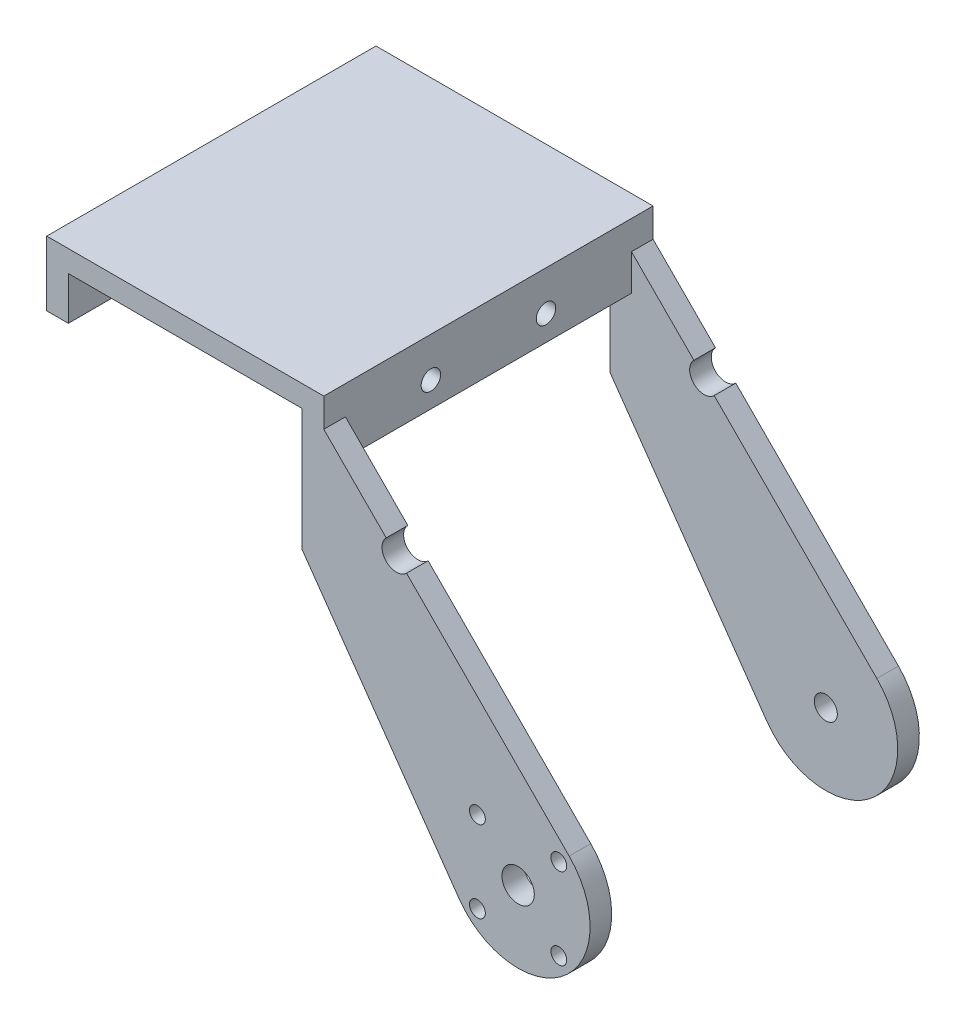
from build123d import *

# Parameters (mm, degrees)
BOSS_EXTRUDE1_DEPTH = 3
SKETCH1_3_W         = 3
SKETCH1_3_H         = 45.75
SKETCH1_3_H_2       = 39.75
BOSS_EXTRUDE2_DEPTH = 9
SKETCH1_4_W         = 3
SKETCH1_4_H         = 45.75
BOSS_EXTRUDE3_DEPTH = 6
CUT_EXTRUDE1_REACH  = 47.678
SKETCH3_R           = 1.35
SKETCH1_5_W         = 3
SKETCH1_5_H         = 3
BOSS_EXTRUDE4_DEPTH = 20
BOSS_EXTRUDE5_DEPTH = 3
SKETCH5_R           = 2.25
SKETCH5_R_2         = 1.1
CUT_EXTRUDE2_DEPTH  = 3
SKETCH6_R           = 1.6
CUT_EXTRUDE3_DEPTH  = 3
CIRPATTERN1_COUNT   = 4
CUT_EXTRUDE4_REACH  = 93.224


with BuildPart() as part:
    # Sketch1 → Boss-Extrude1 (new body)
    with BuildSketch(Plane(origin=(0, 0, 0), x_dir=(1, 0, 0), z_dir=(0, 1, 0))):
        Polygon((16.25, 22.875), (-16.25, 22.875), (-16.25, -22.875), (16.25, -22.875), (16.25, -19.875), (16.25, 19.875), align=None)
    extrude(amount=-BOSS_EXTRUDE1_DEPTH)

    # Sketch1<3> → Boss-Extrude2 (add)
    with BuildSketch(Plane(origin=(0, 0, 0), x_dir=(1, 0, 0), z_dir=(0, 1, 0))):
        with Locations((-17.75, 0)):
            Rectangle(SKETCH1_3_W, SKETCH1_3_H)
        with Locations((17.75, 0)):
            Rectangle(SKETCH1_3_W, SKETCH1_3_H_2)
    extrude(amount=-BOSS_EXTRUDE2_DEPTH)

    # Sketch1<4> → Boss-Extrude3 (add)
    with BuildSketch(Plane(origin=(0, 0, 0), x_dir=(1, 0, 0), z_dir=(0, 1, 0))):
        with Locations((-17.75, 0)):
            Rectangle(SKETCH1_4_W, SKETCH1_4_H)
    extrude(amount=-BOSS_EXTRUDE3_DEPTH)

    # Cut-Extrude1: up to this face of the body (flat: up to its plane)
    cut_extrude1_end = Plane(part.part.faces().sort_by_distance((19.25, -4.5, 0))[0])
    # Sketch3 → Cut-Extrude1 (cut, up to the picked face)
    with BuildSketch(Plane.ZY.offset(19.25), mode=Mode.PRIVATE) as cut_extrude1_sk1:
        with Locations((-8, -5.5)):
            Circle(SKETCH3_R)
    cut_extrude1_tool1 = split(extrude(cut_extrude1_sk1.sketch, amount=-CUT_EXTRUDE1_REACH, mode=Mode.PRIVATE), bisect_by=cut_extrude1_end, keep=Keep.BOTH, mode=Mode.PRIVATE)
    cut_extrude1 = cut_extrude1_tool1.solids().sort_by(Axis((-19.25, -5.5, -8), (1, 0, 0)))[0]
    add(cut_extrude1, mode=Mode.SUBTRACT)

    # Mirror1: Cut-Extrude1 across plane
    add(cut_extrude1.mirror(Plane.XY), mode=Mode.SUBTRACT)

    # Sketch1<5> → Boss-Extrude4 (add)
    with BuildSketch(Plane(origin=(0, 0, 0), x_dir=(1, 0, 0), z_dir=(0, 1, 0))):
        with Locations((17.75, 21.375)):
            Rectangle(SKETCH1_5_W, SKETCH1_5_H)
        with Locations((17.75, -21.375)):
            Rectangle(SKETCH1_5_W, SKETCH1_5_H)
    extrude(amount=-BOSS_EXTRUDE4_DEPTH)

    # Sketch4 → Boss-Extrude5 (add)
    with BuildSketch(Plane.XY.offset(22.875)):
        with BuildLine():
            Line((19.25, -4), (53.343559989, -38.311496139))
            ThreePointArc((53.343559989, -38.311496139), (52.66855868, -53.028253026), (38.062810036, -51.101943964))
            Line((38.062810036, -51.101943964), (16.25, -20))
            Line((16.25, -20), (19.25, -4))
        make_face()
    boss_extrude5 = extrude(amount=-BOSS_EXTRUDE5_DEPTH)

    # Mirror2: Boss-Extrude5 across plane
    add(boss_extrude5.mirror(Plane.XY))

    # Sketch5 → Cut-Extrude2 (cut)
    with BuildSketch(Plane.XY.offset(22.875)):
        with Locations((46.25, -45.36)):
            Circle(SKETCH5_R)
        with Locations((51.906854249, -39.703145751)):
            Circle(SKETCH5_R_2)
    cut_extrude2 = extrude(amount=-CUT_EXTRUDE2_DEPTH, mode=Mode.SUBTRACT)

    # Sketch6 → Cut-Extrude3 (cut)
    with BuildSketch(Plane(origin=(0, 0, -22.875), x_dir=(-1, 0, 0), z_dir=(0, 0, -1))):
        with Locations((-46.25, -45.36)):
            Circle(SKETCH6_R)
    extrude(amount=-CUT_EXTRUDE3_DEPTH, mode=Mode.SUBTRACT)

    # CirPattern1: Cut-Extrude2 ×4 about axis
    cirpattern1_axis = Axis((46.25, -45.36, 0), (0, 0, 1))
    for i in range(1, CIRPATTERN1_COUNT):
        add(cut_extrude2.rotate(cirpattern1_axis, i * 360 / CIRPATTERN1_COUNT), mode=Mode.SUBTRACT)

    # Cut-Extrude4: up to this face of the body (flat: up to its plane)
    cut_extrude4_end = Plane(part.part.faces().sort_by_distance((30.534092, -28.25383722, -22.875))[0])
    # Sketch7 → Cut-Extrude4 (cut, up to the picked face)
    with BuildSketch(Plane.XY.offset(22.875), mode=Mode.PRIVATE) as cut_extrude4_sk1:
        with BuildLine():
            Line((27.924933355, -12.730386103), (30.7443349, -15.567810098))
            ThreePointArc((30.7443349, -15.567810098), (27.915922129, -15.558798873), (27.924933355, -12.730386103))
        make_face()
    cut_extrude4_tool1 = split(extrude(cut_extrude4_sk1.sketch, amount=-CUT_EXTRUDE4_REACH, mode=Mode.PRIVATE), bisect_by=cut_extrude4_end, keep=Keep.BOTH, mode=Mode.PRIVATE)
    add(cut_extrude4_tool1.solids().sort_by(Axis((28.732514, -14.747394, 22.875), (0, 0, -1)))[0], mode=Mode.SUBTRACT)


solid = part.part
